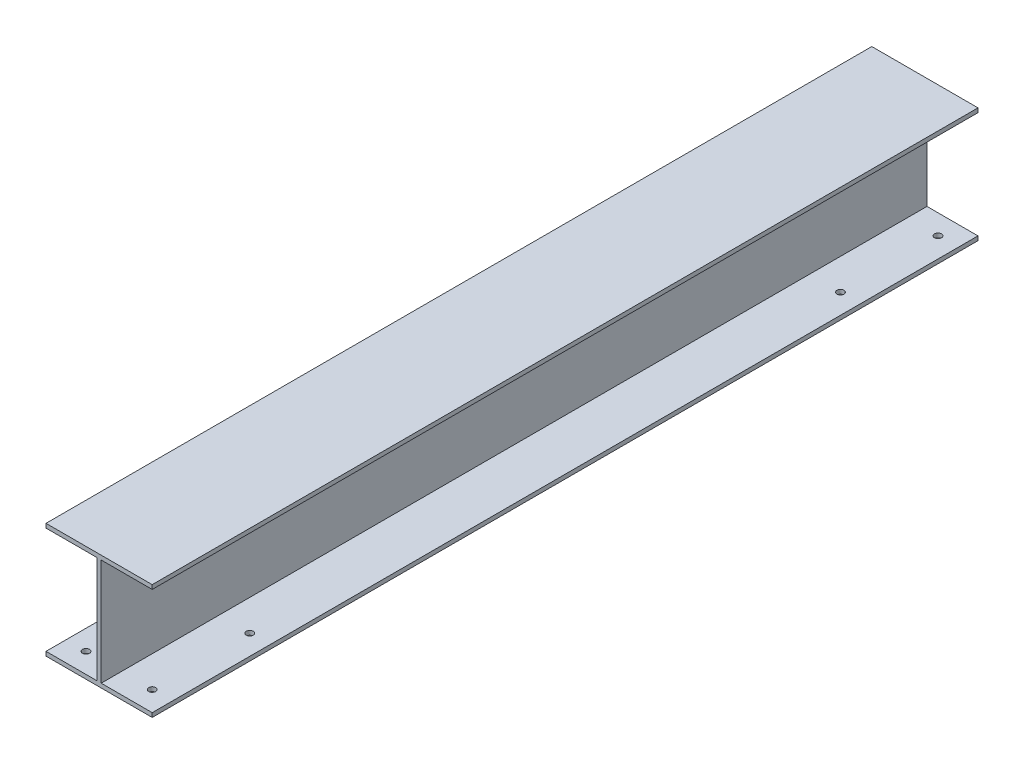
from build123d import *

# Parameters (mm, degrees)
BOSS_EXTRUDE1_DEPTH = 1185
SKETCH3_R           = 5
CUT_EXTRUDE1_DEPTH  = 20


with BuildPart() as part:
    # Sketch1 → Boss-Extrude1 (new body)
    with BuildSketch(Plane.XY):
        Polygon((76.2, 82.55), (-76.2, 82.55), (-76.2, 76.55), (-3, 76.55), (-3, -76.55), (-76.2, -76.55), (-76.2, -82.55), (76.2, -82.55), (76.2, -76.55), (3, -76.55), (3, 76.55), (76.2, 76.55), align=None)
    extrude(amount=BOSS_EXTRUDE1_DEPTH)

    # Sketch3 → Cut-Extrude1 (cut)
    with BuildSketch(Plane.XZ.offset(82.55)):
        with Locations((-47.5, 1156.3)):
            Circle(SKETCH3_R)
        with Locations((47.5, 1156.3)):
            Circle(SKETCH3_R)
        with Locations((-47.5, 1016.3)):
            Circle(SKETCH3_R)
        with Locations((47.5, 1016.3)):
            Circle(SKETCH3_R)
        with Locations((47.5, 168.7)):
            Circle(SKETCH3_R)
        with Locations((-47.5, 168.7)):
            Circle(SKETCH3_R)
        with Locations((47.5, 28.7)):
            Circle(SKETCH3_R)
        with Locations((-47.5, 28.7)):
            Circle(SKETCH3_R)
    extrude(amount=-CUT_EXTRUDE1_DEPTH, mode=Mode.SUBTRACT)


solid = part.part
